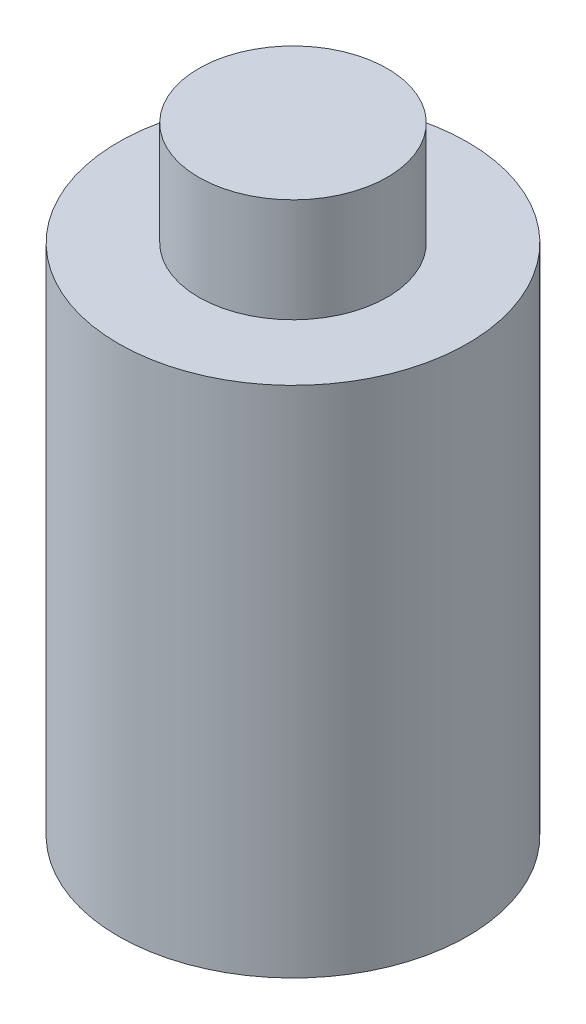
from build123d import *

# Parameters (mm, degrees)
SKETCH1_R           = 5
SKETCH1_R_2         = 2.7
BOSS_EXTRUDE1_DEPTH = 14.7
SKETCH1_2_R         = 2.7
BOSS_EXTRUDE2_DEPTH = 17.675


with BuildPart() as part:
    # Sketch1 → Boss-Extrude1 (new body)
    with BuildSketch(Plane(origin=(0, 0, 0), x_dir=(1, 0, 0), z_dir=(0, 1, 0))):
        Circle(SKETCH1_R)
        Circle(SKETCH1_R_2, mode=Mode.SUBTRACT)
    extrude(amount=BOSS_EXTRUDE1_DEPTH)

    # Sketch1<2> → Boss-Extrude2 (add)
    with BuildSketch(Plane(origin=(0, 0, 0), x_dir=(1, 0, 0), z_dir=(0, 1, 0))):
        Circle(SKETCH1_2_R)
    extrude(amount=BOSS_EXTRUDE2_DEPTH)


solid = part.part
